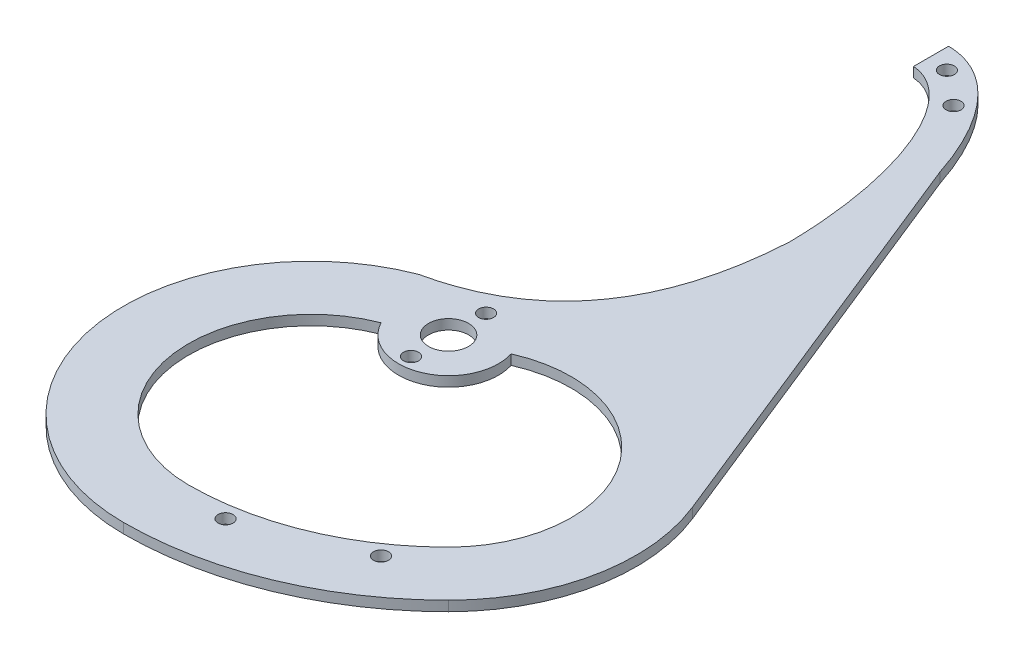
from build123d import *

# Parameters (mm, degrees)
SKETCH_1_R          = 1.5
SKETCH_1_R_2        = 4
EXTRUDE_1_DEPTH     = 2
SKETCH_2_R          = 1.5
CUT_EXTRUDE_1_DEPTH = 116.094668721


with BuildPart() as part:
    # Эскиз1 → Бобышка-Вытянуть1 (new body)
    with BuildSketch(Plane(origin=(0, 0, 0), x_dir=(1, 0, 0), z_dir=(0, 1, 0))):
        with BuildLine():
            Line((54.236033393, -5.45028137), (20.920510558, 77.368874006))
            add(Edge.make_bspline(
                [(20.920510558, 77.368874006), (13.519104954, 99.996768719), (0, 100)],
                knots=[2.149983836, 2.149983836, 2.149983836, 3.14143331, 3.14143331, 3.14143331], degree=2, weights=[1, 0.879624206, 1]))
            Line((0, 100), (0, 93))
            add(Edge.make_bspline(
                [(18.005142203, 50.270253613), (17.382191681, 91.773168681), (0, 93)],
                knots=[1.570796327, 1.570796327, 1.570796327, 3.105746544, 3.105746544, 3.105746544], degree=2, weights=[1, 0.719666045, 1]))
            add(Edge.make_bspline(
                [(-13.452394346, 7.504043857), (16.003264405, 13.845732338), (18.005142203, 50.270253613)],
                knots=[0, 0, 0, 1, 1, 1], degree=2))
            ThreePointArc((-13.452394346, 7.504043857), (-36.870731242, -34.340992448), (0, -65))
            ThreePointArc((0, -65), (24.874423104, -60.052169613), (45.961940777, -45.961940777))
            ThreePointArc((45.961940777, -45.961940777), (56.186949809, -26.949515273), (54.236033393, -5.45028137))
        make_face()
        with Locations(Location((9.550649772, -54.164426416, 0), (0, 0, 270))):
            Circle(SKETCH_1_R, mode=Mode.SUBTRACT)
        with Locations(Location((31.546703999, -45.053362436, 0), (0, 0, 90))):
            Circle(SKETCH_1_R, mode=Mode.SUBTRACT)
        with Locations(Location((0, 0, 0), (0, 0, 270))):
            Circle(SKETCH_1_R_2, mode=Mode.SUBTRACT)
        with Locations(Location((0, -7.5, 0), (0, 0, 270))):
            Circle(SKETCH_1_R, mode=Mode.SUBTRACT)
        with Locations(Location((0, 7.5, 0), (0, 0, 270))):
            Circle(SKETCH_1_R, mode=Mode.SUBTRACT)
        with BuildLine():
            ThreePointArc((0, -52), (19.899538483, -48.041735691), (36.769552622, -36.769552622))
            ThreePointArc((36.769552622, -36.769552622), (39.657964622, -5.59972573), (9.54966327, 2.967141962))
            ThreePointArc((9.54966327, 2.967141962), (7.071067812, -7.071067812), (-2.967141962, -9.54966327))
            ThreePointArc((-2.967141962, -9.54966327), (-6.395779647, -7.687262368), (-8.850717859, -4.654545455))
            ThreePointArc((-8.850717859, -4.654545455), (-24.082811675, -32.002019749), (0, -52))
        make_face(mode=Mode.SUBTRACT)
    extrude(amount=EXTRUDE_1_DEPTH)

    # Эскиз2 → Вырез-Вытянуть1 (cut, through all)
    with BuildSketch(Plane.XZ):
        with Locations(Location((3.997292475, -95.689262056, 0), (0, 0, 270))):
            Circle(SKETCH_2_R)
        with Locations(Location((10.780229305, -90.232363482, 0), (0, 0, 270))):
            Circle(SKETCH_2_R)
    extrude(amount=-CUT_EXTRUDE_1_DEPTH, mode=Mode.SUBTRACT)


solid = part.part
